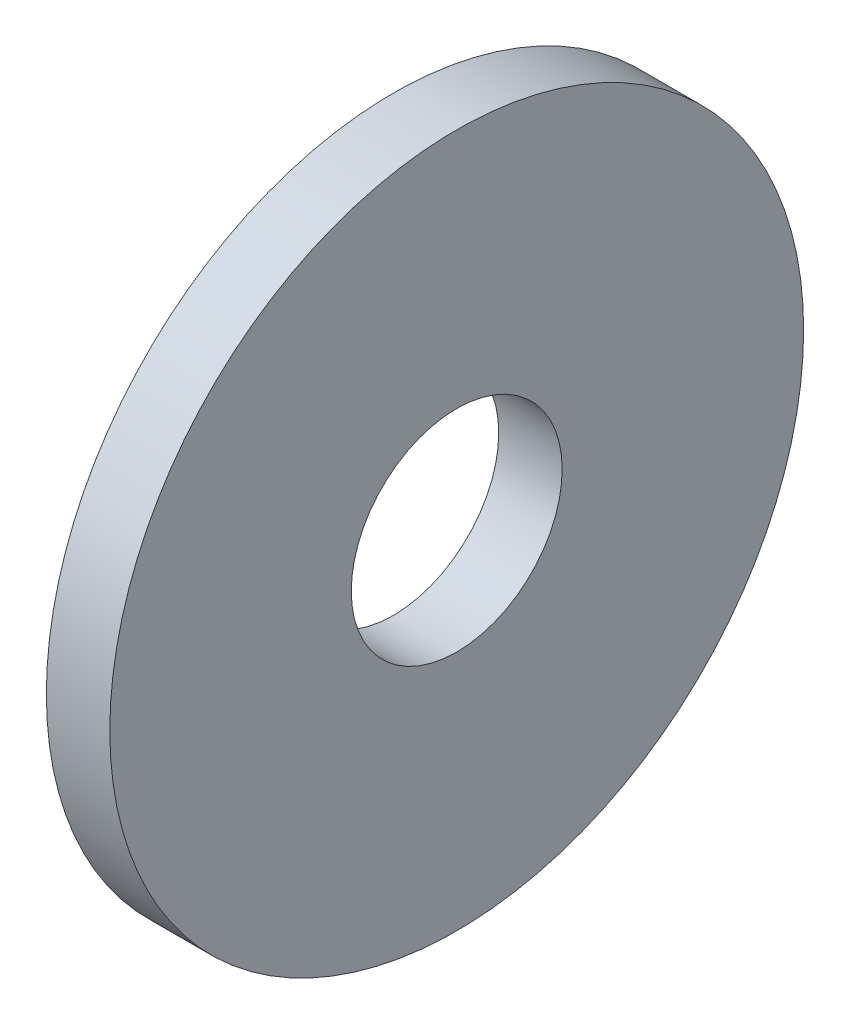
from build123d import *

# Parameters (mm, degrees)
SKETCH1_R           = 11.1125
SKETCH1_R_2         = 3.3782
BOSS_EXTRUDE1_DEPTH = 2.032


with BuildPart() as part:
    # Sketch1 → Boss-Extrude1 (new body)
    with BuildSketch(Plane(origin=(0, 0, 0), x_dir=(0, 0, -1), z_dir=(1, 0, 0))):
        Circle(SKETCH1_R)
        Circle(SKETCH1_R_2, mode=Mode.SUBTRACT)
    extrude(amount=BOSS_EXTRUDE1_DEPTH)


solid = part.part
